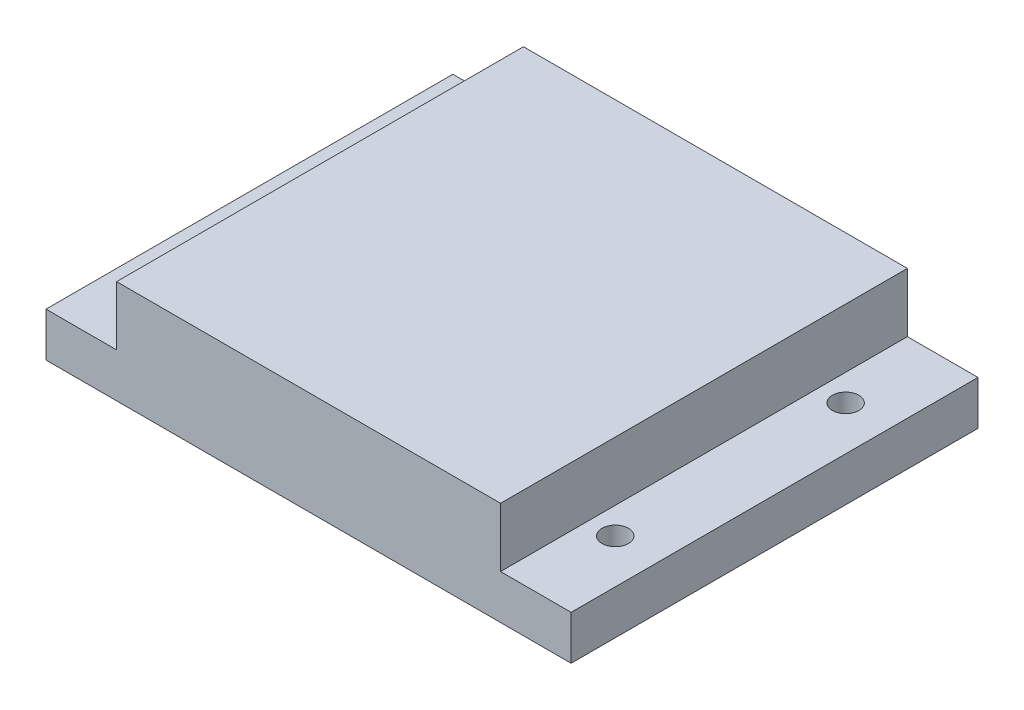
from build123d import *

# Parameters (mm, degrees)
EXTRUDE_1_DEPTH     = 46.1
SKETCH_2_R          = 1.5
CUT_EXTRUDE_1_DEPTH = 77.173158002


with BuildPart() as part:
    # 草图1 → 凸台-拉伸1 (new body)
    with BuildSketch(Plane.XY):
        Polygon((0, 0), (0, 5), (8, 5), (8, 11.7), (51.5, 11.7), (51.5, 5), (59.5, 5), (59.5, 0), align=None)
    extrude(amount=EXTRUDE_1_DEPTH)

    # 草图2 → 切除-拉伸1 (cut, through all)
    with BuildSketch(Plane.XZ):
        with Locations(Location((5, 36.1, 0), (0, 0, 270))):
            Circle(SKETCH_2_R)
        with Locations(Location((5, 10, 0), (0, 0, 270))):
            Circle(SKETCH_2_R)
        with Locations(Location((54.5, 36.1, 0), (0, 0, 270))):
            Circle(SKETCH_2_R)
        with Locations(Location((54.5, 10, 0), (0, 0, 270))):
            Circle(SKETCH_2_R)
    extrude(amount=-CUT_EXTRUDE_1_DEPTH, mode=Mode.SUBTRACT)


solid = part.part
